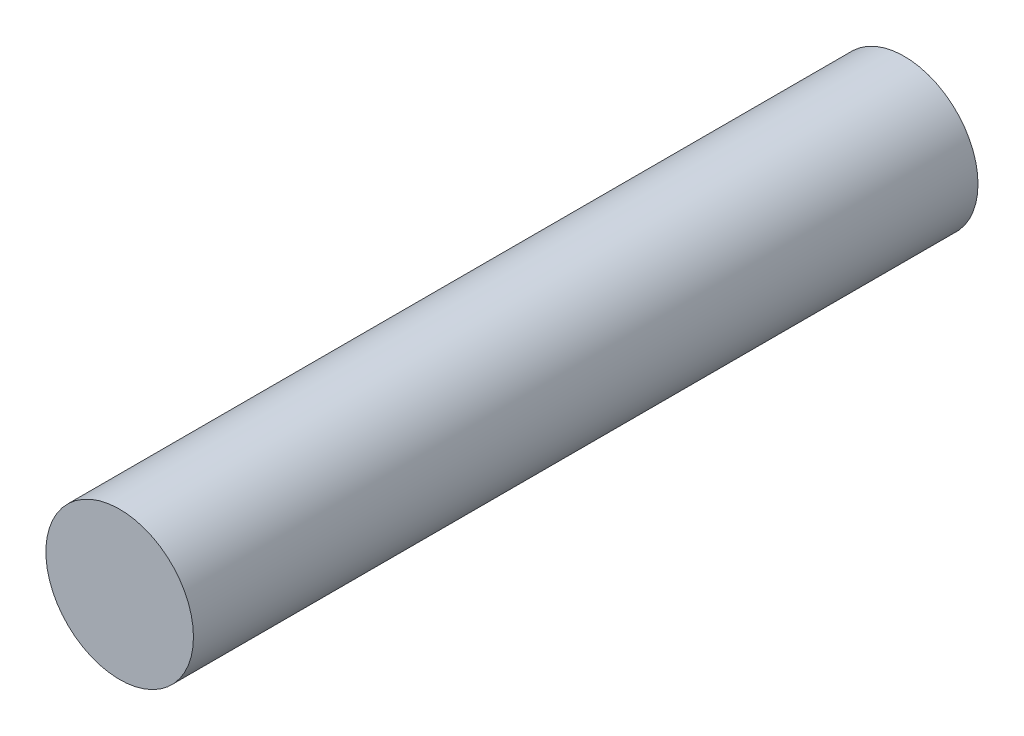
from build123d import *

# Parameters (mm, degrees)
SKETCH1_R           = 1.505
BOSS_EXTRUDE1_DEPTH = 16


with BuildPart() as part:
    # Sketch1 → Boss-Extrude1 (new body)
    with BuildSketch(Plane.XY):
        Circle(SKETCH1_R)
    extrude(amount=BOSS_EXTRUDE1_DEPTH)


solid = part.part
